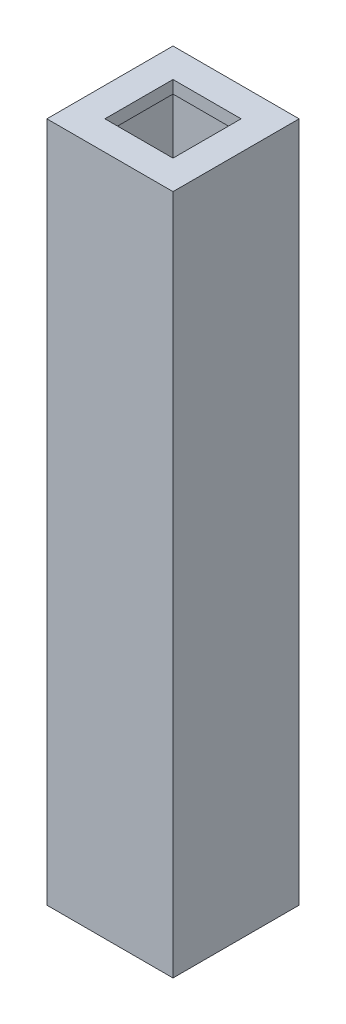
from build123d import *

# Parameters (mm, degrees)
SKETCH_1_W          = 10
SKETCH_1_H          = 10
SKETCH_1_W_2        = 6.2
SKETCH_1_H_2        = 6.2
EXTRUDE_1_DEPTH     = 54
EXTRUDE_START       = 54
SKETCH_1_3_W        = 10
SKETCH_1_3_H        = 10
SKETCH_1_3_W_2      = 6.2
SKETCH_1_3_H_2      = 6.2
SKETCH_1_3_W_3      = 5.4
SKETCH_1_3_H_3      = 5.4
EXTRUDE_2_DEPTH     = 1
SKETCH_2_R          = 0.3
CUT_EXTRUDE_1_DEPTH = 2


with BuildPart() as part:
    # 草图1 → 凸台-拉伸1 (new body)
    with BuildSketch(Plane(origin=(0, 0, 0), x_dir=(1, 0, 0), z_dir=(0, 1, 0))):
        Rectangle(SKETCH_1_W, SKETCH_1_H)
        Rectangle(SKETCH_1_W_2, SKETCH_1_H_2, mode=Mode.SUBTRACT)
    extrude(amount=EXTRUDE_1_DEPTH)

    # 草图1<3> → 凸台-拉伸2 (add)
    # profile 1 of 2: a face of its own
    with BuildSketch(Plane(origin=(0, 0, 0), x_dir=(1, 0, 0), z_dir=(0, 1, 0)).offset(EXTRUDE_START)):
        Rectangle(SKETCH_1_3_W, SKETCH_1_3_H)
        Rectangle(SKETCH_1_3_W_2, SKETCH_1_3_H_2, mode=Mode.SUBTRACT)
    # profile 2 of 2: a face of its own
    with BuildSketch(Plane(origin=(0, 0, 0), x_dir=(1, 0, 0), z_dir=(0, 1, 0)).offset(EXTRUDE_START)):
        Rectangle(SKETCH_1_3_W_2, SKETCH_1_3_H_2)
        Rectangle(SKETCH_1_3_W_3, SKETCH_1_3_H_3, mode=Mode.SUBTRACT)
    extrude(amount=-EXTRUDE_2_DEPTH)

    # 草图2 → 切除-拉伸1 (cut)
    with BuildSketch(Plane.XZ):
        with Locations(Location((-4, 4, 0), (0, 0, 270))):
            Circle(SKETCH_2_R)
        with Locations(Location((4, -4, 0), (0, 0, 270))):
            Circle(SKETCH_2_R)
        with Locations(Location((4, 4, 0), (0, 0, 270))):
            Circle(SKETCH_2_R)
        with Locations(Location((-4, -4, 0), (0, 0, 270))):
            Circle(SKETCH_2_R)
    extrude(amount=-CUT_EXTRUDE_1_DEPTH, mode=Mode.SUBTRACT)


solid = part.part
